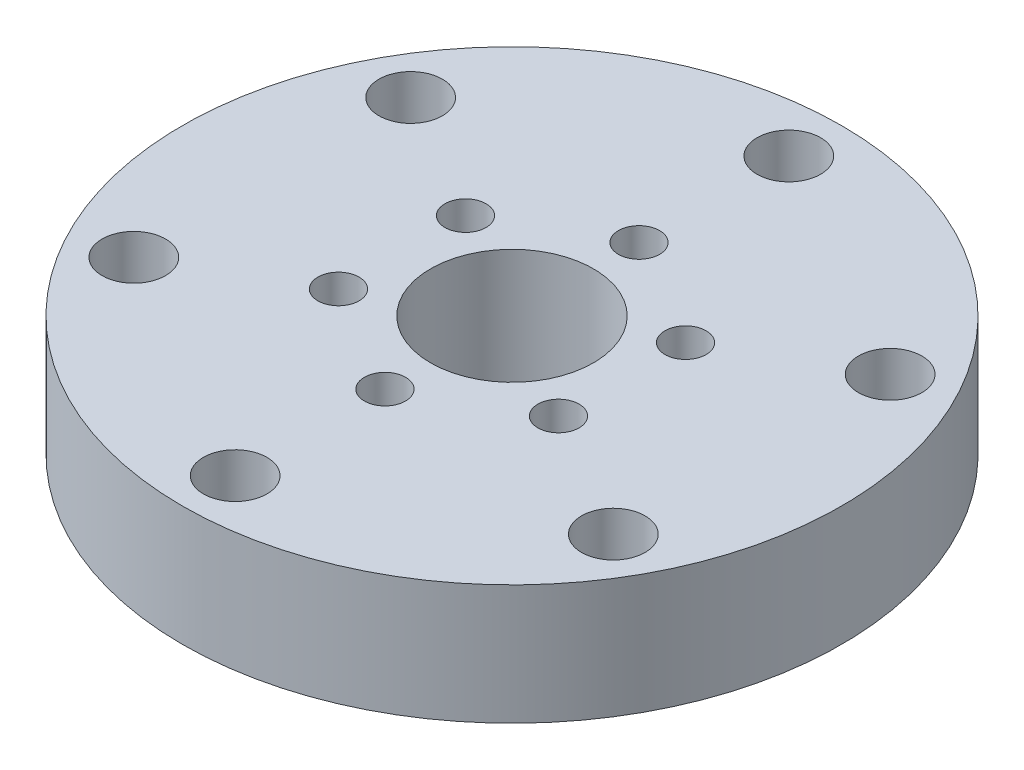
from build123d import *

# Parameters (mm, degrees)
SKETCH1_R          = 34.925
EXTRUDE1_DEPTH     = 12.7
SKETCH2_R          = 8.636
CUT_EXTRUDE1_DEPTH = 51.998051433
SKETCH3_R          = 3.3655
CUT_EXTRUDE2_DEPTH = 12.7
CIRPATTERN1_COUNT  = 6
SKETCH5_R          = 2.1844
CUT_EXTRUDE4_DEPTH = 51.998051433
CIRPATTERN2_COUNT  = 6


with BuildPart() as part:
    # Sketch1 → Extrude1 (new body)
    with BuildSketch(Plane(origin=(0, 0, 0), x_dir=(1, 0, 0), z_dir=(0, 1, 0))):
        Circle(SKETCH1_R)
    extrude(amount=EXTRUDE1_DEPTH)

    # Sketch2 → Cut-Extrude1 (cut, through all)
    with BuildSketch(Plane(origin=(0, 0, 0), x_dir=(1, 0, 0), z_dir=(0, 1, 0))):
        Circle(SKETCH2_R)
    extrude(amount=CUT_EXTRUDE1_DEPTH, mode=Mode.SUBTRACT)

    # Sketch3 → Cut-Extrude2 (cut)
    with BuildSketch(Plane(origin=(0, 0, 0), x_dir=(1, 0, 0), z_dir=(0, 1, 0))):
        with Locations((0, 29.337)):
            Circle(SKETCH3_R)
    cut_extrude2 = extrude(amount=CUT_EXTRUDE2_DEPTH, mode=Mode.SUBTRACT)

    # CirPattern1: Cut-Extrude2 ×6 about axis
    cirpattern1_axis = Axis((0, 35.858162691, 0), (0, -1, 0))
    for i in range(1, CIRPATTERN1_COUNT):
        add(cut_extrude2.rotate(cirpattern1_axis, i * 360 / CIRPATTERN1_COUNT), mode=Mode.SUBTRACT)

    # Sketch5 → Cut-Extrude4 (cut, through all)
    with BuildSketch(Plane(origin=(0, 0, 0), x_dir=(1, 0, 0), z_dir=(0, 1, 0))):
        with Locations((0, 13.462)):
            Circle(SKETCH5_R)
    cut_extrude4 = extrude(amount=CUT_EXTRUDE4_DEPTH, mode=Mode.SUBTRACT)

    # CirPattern2: Cut-Extrude4 ×6 about axis
    cirpattern2_axis = Axis((0, 35.858162691, 0), (0, -1, 0))
    for i in range(1, CIRPATTERN2_COUNT):
        add(cut_extrude4.rotate(cirpattern2_axis, i * 360 / CIRPATTERN2_COUNT), mode=Mode.SUBTRACT)


solid = part.part
